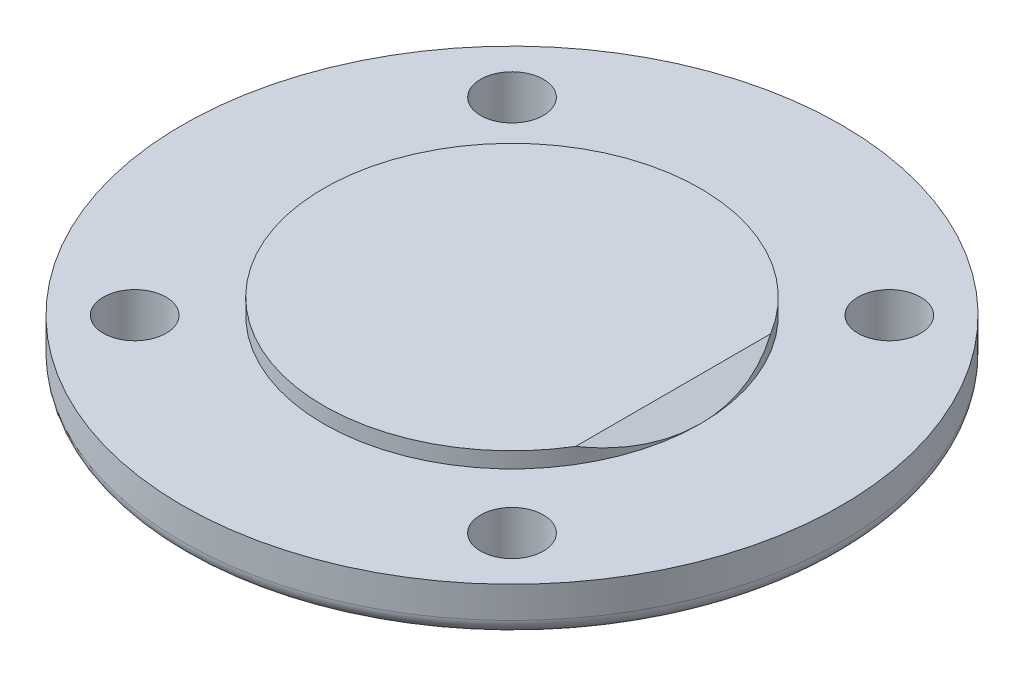
from build123d import *

# Parameters (mm, degrees)
SKETCH1_R           = 21
BOSS_EXTRUDE1_DEPTH = 3
SKETCH2_R           = 12
BOSS_EXTRUDE2_DEPTH = 1
CUT_EXTRUDE1_START  = -3
SKETCH2_2_R         = 12
CUT_EXTRUDE1_DEPTH  = 1
SKETCH3_R           = 2
CUT_EXTRUDE2_DEPTH  = 30.849623113
CIRPATTERN1_COUNT   = 4
FILLET1_R           = 1
CUT_EXTRUDE3_DEPTH  = 35.5


with BuildPart() as part:
    # Sketch1 → Boss-Extrude1 (new body)
    with BuildSketch(Plane(origin=(0, 0, 0), x_dir=(1, 0, 0), z_dir=(0, 1, 0))):
        Circle(SKETCH1_R)
    extrude(amount=BOSS_EXTRUDE1_DEPTH)

    # Sketch2 → Boss-Extrude2 (add)
    with BuildSketch(Plane(origin=(0, 3, 0), x_dir=(1, 0, 0), z_dir=(0, 1, 0))):
        Circle(SKETCH2_R)
    extrude(amount=BOSS_EXTRUDE2_DEPTH)

    # Sketch2<2> → Cut-Extrude1 (cut)
    with BuildSketch(Plane(origin=(0, 3, 0), x_dir=(1, 0, 0), z_dir=(0, 1, 0)).offset(CUT_EXTRUDE1_START)):
        Circle(SKETCH2_2_R)
    extrude(amount=CUT_EXTRUDE1_DEPTH, mode=Mode.SUBTRACT)

    # Sketch3 → Cut-Extrude2 (cut, through all)
    with BuildSketch(Plane(origin=(0, 3, 0), x_dir=(1, 0, 0), z_dir=(0, 1, 0))):
        with Locations((12.02081528, 12.02081528)):
            Circle(SKETCH3_R)
    cut_extrude2 = extrude(amount=-CUT_EXTRUDE2_DEPTH, mode=Mode.SUBTRACT)

    # CirPattern1: Cut-Extrude2 ×4 about axis
    cirpattern1_axis = Axis((0, 3, 0), (0, -1, 0))
    for i in range(1, CIRPATTERN1_COUNT):
        add(cut_extrude2.rotate(cirpattern1_axis, i * 360 / CIRPATTERN1_COUNT), mode=Mode.SUBTRACT)

    # Fillet1
    fillet1_edges = [part.edges().sort_by_distance(p)[0] for p in [
        (-21, 0, 0),
    ]]
    fillet(fillet1_edges, radius=FILLET1_R)

    # Sketch4 → Cut-Extrude3 (cut, symmetric)
    with BuildSketch(Plane.XY):
        Polygon((12, 3), (10.267949192, 4), (12, 4), align=None)
    extrude(amount=CUT_EXTRUDE3_DEPTH, both=True, mode=Mode.SUBTRACT)


solid = part.part
